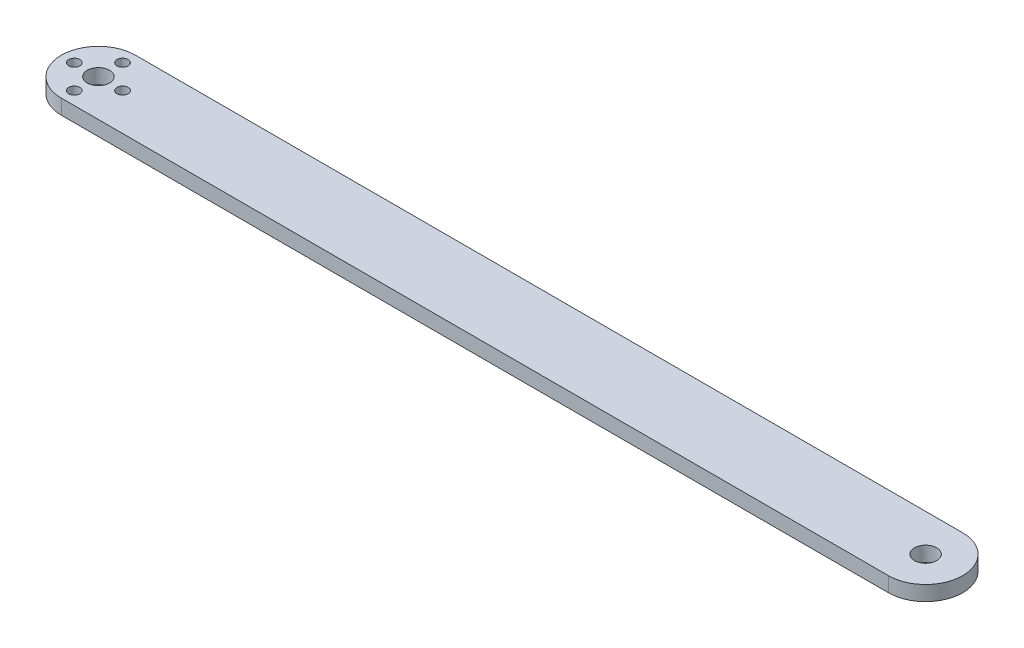
from build123d import *

# Parameters (mm, degrees)
SKETCH_1_R               = 3
EXTRUDE_1_DEPTH          = 4
SKETCH_2_R               = 1.5
CUT_EXTRUDE_1_DEPTH      = 4
PATTERN_CIRCULAR_1_COUNT = 4


with BuildPart() as part:
    # 草图1 → 凸台-拉伸1 (new body)
    with BuildSketch(Plane(origin=(0, 0, 0), x_dir=(1, 0, 0), z_dir=(0, 1, 0))):
        with BuildLine():
            Line((-111.375, 10), (111.375, 10))
            ThreePointArc((111.375, 10), (121.375, 0), (111.375, -10))
            Line((111.375, -10), (-111.375, -10))
            ThreePointArc((-111.375, -10), (-121.375, 0), (-111.375, 10))
        make_face()
        with Locations(Location((-111.375, 0, 0), (0, 0, 270))):
            Circle(SKETCH_1_R, mode=Mode.SUBTRACT)
        with Locations(Location((111.375, 0, 0), (0, 0, 270))):
            Circle(SKETCH_1_R, mode=Mode.SUBTRACT)
    extrude(amount=EXTRUDE_1_DEPTH)

    # 草图2 → 切除-拉伸1 (cut)
    with BuildSketch(Plane(origin=(0, 4, 0), x_dir=(1, 0, 0), z_dir=(0, 1, 0))):
        with Locations(Location((-111.375, 6.5, 0), (0, 0, 270))):
            Circle(SKETCH_2_R)
    cut_extrude_1 = extrude(amount=-CUT_EXTRUDE_1_DEPTH, mode=Mode.SUBTRACT)

    # 阵列(圆周)1: 切除-拉伸1 ×4 about axis
    pattern_circular_1_axis = Axis((-111.375, 0, 0), (0, 1, 0))
    for i in range(1, PATTERN_CIRCULAR_1_COUNT):
        add(cut_extrude_1.rotate(pattern_circular_1_axis, i * 360 / PATTERN_CIRCULAR_1_COUNT), mode=Mode.SUBTRACT)


solid = part.part
